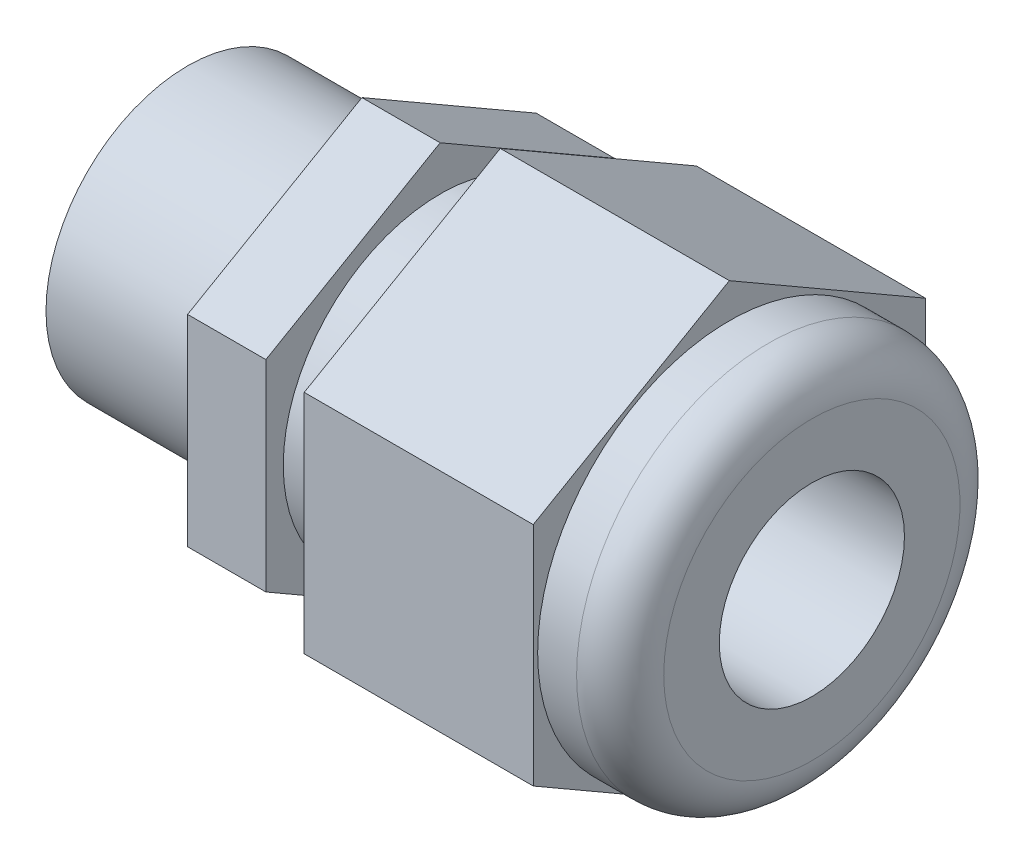
from build123d import *

# Parameters (mm, degrees)
SKETCH2_R          = 15.716456716
CUT_EXTRUDE2_DEPTH = 12
SKETCH3_R          = 15.643449511
CUT_EXTRUDE3_DEPTH = 5
FILLET1_R          = 2


with BuildPart() as part:
    # Sketch1 → Revolve1 (revolve)
    with BuildSketch(Plane.XY, mode=Mode.PRIVATE) as revolve1_sk:
        Polygon((0, 4.25), (28.652506034, 4.25), (28.652506034, 8.798665847), (24.864443275, 8.798665847), (24.864443275, 11), (14.352506034, 11), (14.352506034, 7.20220566), (11.591810477, 7.20220566), (11.591810477, 10), (8, 10), (8, 6.5), (0, 6.5), align=None)
    revolve(revolve1_sk.sketch.rotate(Axis((0, 0, 0), (1, 0, 0)), 90), axis=Axis((0, 0, 0), (1, 0, 0)))

    # Sketch2 → Cut-Extrude2 (cut)
    with BuildSketch(Plane(origin=(24.864443275, 0, 0), x_dir=(0, 0, -1), z_dir=(1, 0, 0))):
        Circle(SKETCH2_R)
        Polygon((0, 10.392304845), (-9, 5.196152423), (-9, -5.196152423), (0, -10.392304845), (9, -5.196152423), (9, 5.196152423), align=None, mode=Mode.SUBTRACT)
    extrude(amount=-CUT_EXTRUDE2_DEPTH, mode=Mode.SUBTRACT)

    # Sketch3 → Cut-Extrude3 (cut)
    with BuildSketch(Plane.ZY.offset(-8)):
        Circle(SKETCH3_R)
        Polygon((0, 9.237604307), (-8, 4.618802154), (-8, -4.618802154), (0, -9.237604307), (8, -4.618802154), (8, 4.618802154), align=None, mode=Mode.SUBTRACT)
    extrude(amount=-CUT_EXTRUDE3_DEPTH, mode=Mode.SUBTRACT)

    # Fillet1
    fillet1_edges = [part.edges().sort_by_distance(p)[0] for p in [
        (28.652506034, 0, -8.798665847),
    ]]
    fillet(fillet1_edges, radius=FILLET1_R)


solid = part.part
